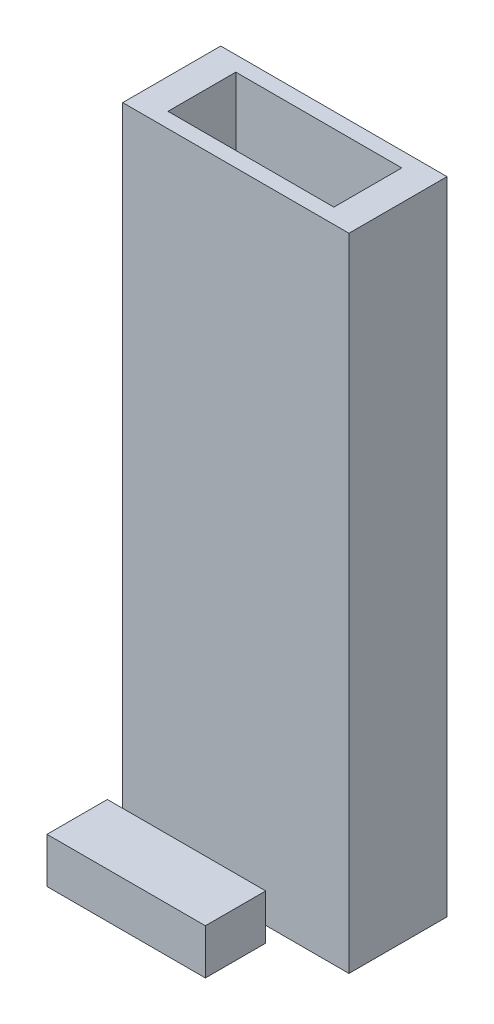
from build123d import *

# Parameters (mm, degrees)
SKETCH1_W           = 30
SKETCH1_H           = 13
BOSS_EXTRUDE1_DEPTH = 85
SKETCH2_W           = 22
SKETCH2_H           = 9
CUT_EXTRUDE2_DEPTH  = 85
SKETCH4_W           = 21
SKETCH4_H           = 8
BOSS_EXTRUDE2_DEPTH = 6


with BuildPart() as part:
    # Sketch1 → Boss-Extrude1 (new body)
    with BuildSketch(Plane(origin=(0, 0, 0), x_dir=(1, 0, 0), z_dir=(0, 1, 0))):
        with Locations((15, -6.5)):
            Rectangle(SKETCH1_W, SKETCH1_H)
    extrude(amount=BOSS_EXTRUDE1_DEPTH)

    # Sketch2 → Cut-Extrude2 (cut)
    with BuildSketch(Plane(origin=(0, 85, 0), x_dir=(1, 0, 0), z_dir=(0, 1, 0))):
        with Locations((15, -6.5)):
            Rectangle(SKETCH2_W, SKETCH2_H)
    extrude(amount=-CUT_EXTRUDE2_DEPTH, mode=Mode.SUBTRACT)


with BuildPart() as body_2:
    # Sketch4 → Boss-Extrude2 (new body)
    with BuildSketch(Plane(origin=(0, 0, 0), x_dir=(1, 0, 0), z_dir=(0, 1, 0))):
        with Locations((10.5, -19.036435156)):
            Rectangle(SKETCH4_W, SKETCH4_H)
    extrude(amount=BOSS_EXTRUDE2_DEPTH)


solid = Compound([part.part, body_2.part])
